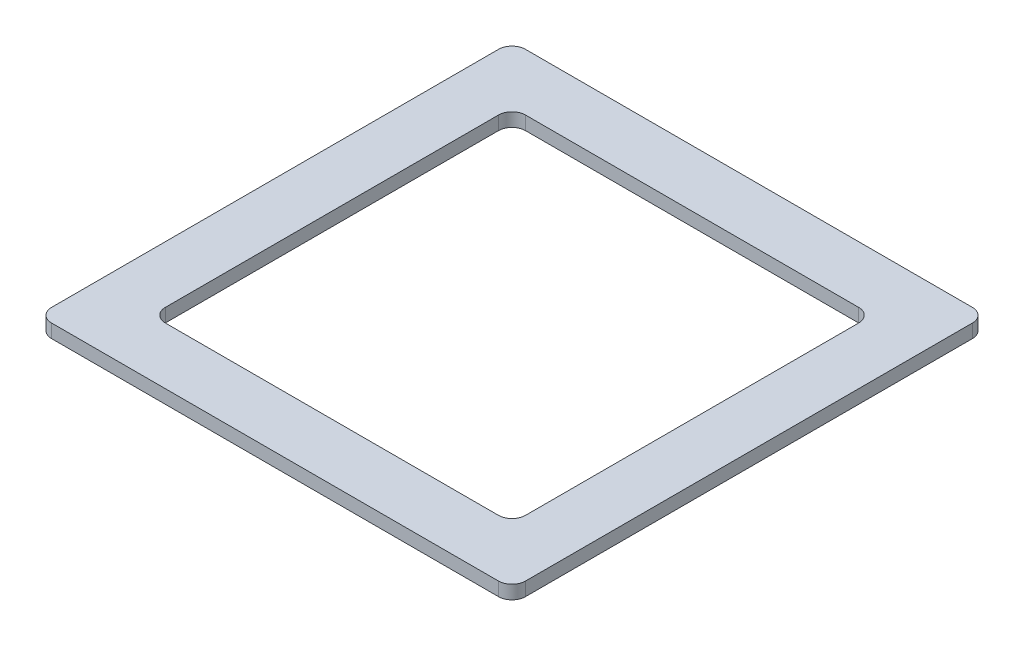
from build123d import *

# Parameters (mm, degrees)
SKETCH1_W           = 350
SKETCH1_H           = 350
BOSS_EXTRUDE1_DEPTH = 10
SKETCH2_W           = 266
SKETCH2_H           = 266
CUT_EXTRUDE1_DEPTH  = 248.68932153
FILLET1_R           = 10


with BuildPart() as part:
    # Sketch1 → Boss-Extrude1 (new body)
    with BuildSketch(Plane(origin=(0, 0, 0), x_dir=(1, 0, 0), z_dir=(0, 1, 0))):
        Rectangle(SKETCH1_W, SKETCH1_H)
    extrude(amount=BOSS_EXTRUDE1_DEPTH)

    # Sketch2 → Cut-Extrude1 (cut, through all)
    with BuildSketch(Plane(origin=(0, 10, 0), x_dir=(1, 0, 0), z_dir=(0, 1, 0))):
        Rectangle(SKETCH2_W, SKETCH2_H)
    extrude(amount=-CUT_EXTRUDE1_DEPTH, mode=Mode.SUBTRACT)

    # Fillet1
    fillet1_edges = [part.edges().sort_by_distance(p)[0] for p in [
        (133, 5, -133),
        (133, 5, 133),
        (-133, 5, 133),
        (-133, 5, -133),
        (175, 5, 175),
        (-175, 5, 175),
        (-175, 5, -175),
        (175, 5, -175),
    ]]
    fillet(fillet1_edges, radius=FILLET1_R)


solid = part.part
